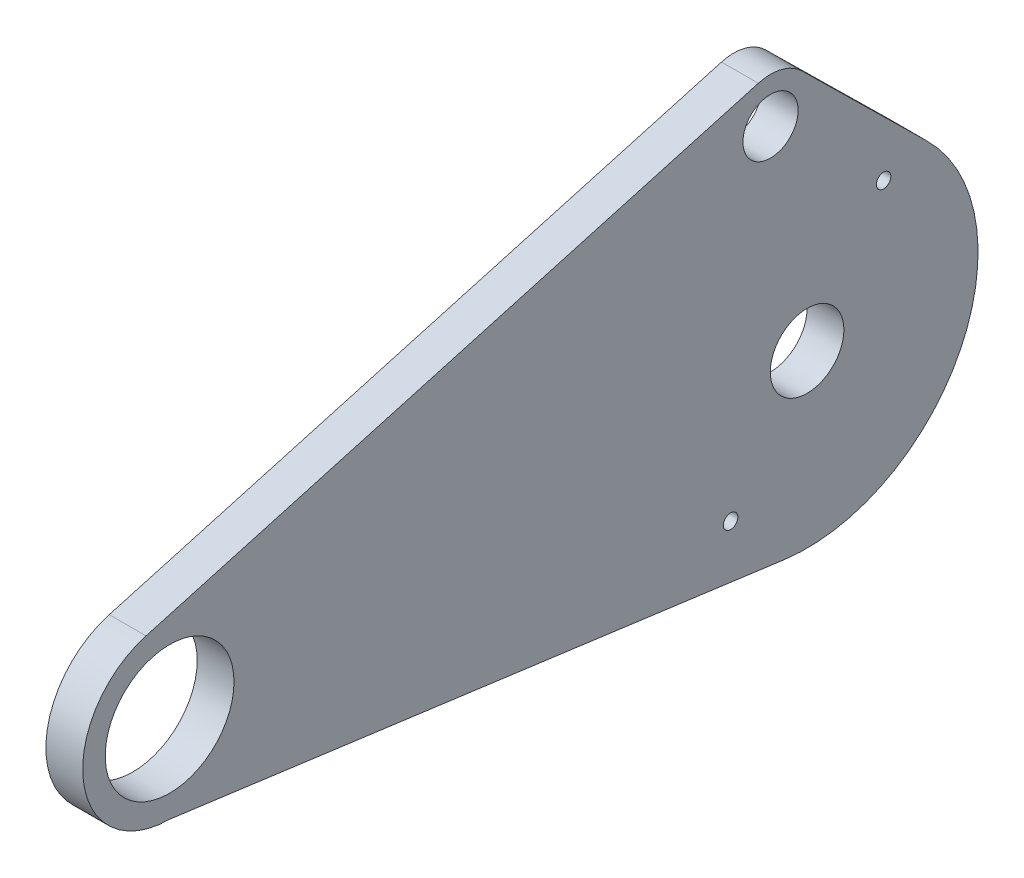
from build123d import *

# Parameters (mm, degrees)
SKETCH1_R             = 11.1125
SKETCH1_R_2           = 6.35
SKETCH1_R_3           = 4.7625
BOSS_EXTRUDE1_DEPTH   = 3.175
M3X0_5_TAPPED_HOLE1_D = 2.5


with BuildPart() as part:
    # Sketch1 → Boss-Extrude1 (new, symmetric)
    with BuildSketch(Plane(origin=(0, 0, 0), x_dir=(0, 0, -1), z_dir=(1, 0, 0))):
        with BuildLine():
            ThreePointArc((109.135384069, 42.254910239), (105.621138378, 44.242227481), (101.584158555, 44.195897144))
            Line((101.584158555, 44.195897144), (-4.066677309, 14.438217884))
            ThreePointArc((-4.066677309, 14.438217884), (-14.858890744, -2.052648501), (0, -15))
            Line((0, -15), (106.075609583, -29.237803609))
            ThreePointArc((106.075609583, -29.237803609), (136.491140548, -12.979579055), (130.699290202, 21.018786481))
            Line((130.699290202, 21.018786481), (109.135384069, 42.254910239))
        make_face()
        Circle(SKETCH1_R, mode=Mode.SUBTRACT)
        with Locations((110, 0)):
            Circle(SKETCH1_R_2, mode=Mode.SUBTRACT)
        with Locations((103.688664063, 36.724119389)):
            Circle(SKETCH1_R_3, mode=Mode.SUBTRACT)
    extrude(amount=BOSS_EXTRUDE1_DEPTH, both=True)

    # M3x0.5 Tapped Hole1 (through all)
    with Locations(Plane(origin=(3.175, 0, 0), x_dir=(0, 0, -1), z_dir=(1, 0, 0))):
        with Locations((123.200861683, 18.852784299), (110, 0), (96.799138317, -18.852784299)):
            Hole(M3X0_5_TAPPED_HOLE1_D / 2)


solid = part.part
